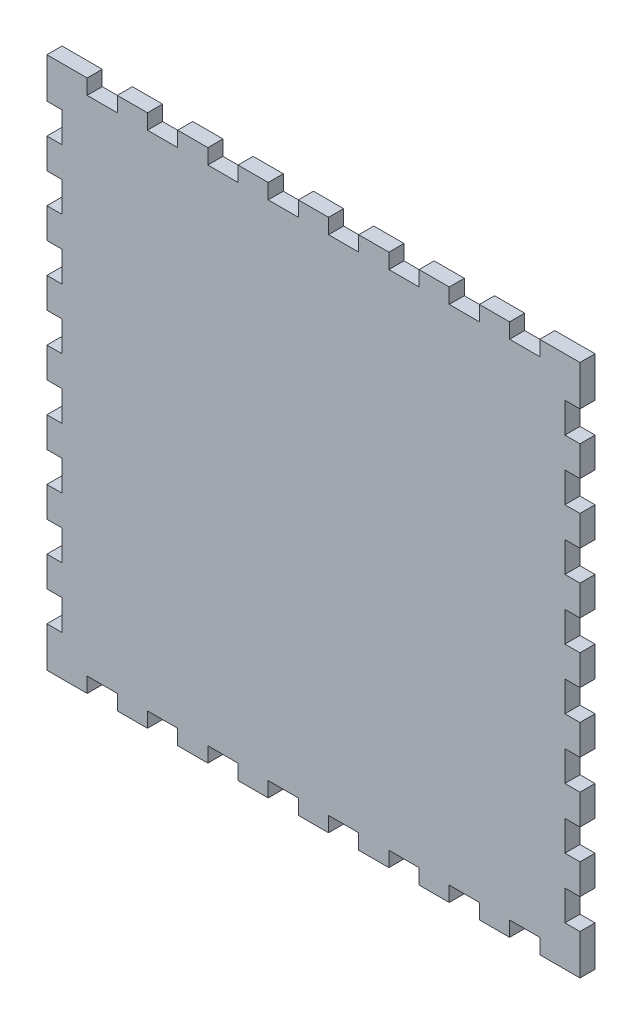
from build123d import *

# Parameters (mm, degrees)
BOSS_EXTRUDE1_DEPTH = 6


with BuildPart() as part:
    # Model → Boss-Extrude1 (new body)
    with BuildSketch(Plane.XY):
        Polygon((0, 215), (0, 199), (6, 199), (6, 187), (0, 187), (0, 175), (6, 175), (6, 163), (0, 163), (0, 151), (6, 151), (6, 139), (0, 139), (0, 127), (6, 127), (6, 115), (0, 115), (0, 103), (6, 103), (6, 91), (0, 91), (0, 79), (6, 79), (6, 67), (0, 67), (0, 55), (6, 55), (6, 43), (0, 43), (0, 31), (6, 31), (6, 19), (0, 19), (0, 3), (16, 3), (16, 9), (28, 9), (28, 3), (40, 3), (40, 9), (52, 9), (52, 3), (64, 3), (64, 9), (76, 9), (76, 3), (88, 3), (88, 9), (100, 9), (100, 3), (112, 3), (112, 9), (124, 9), (124, 3), (136, 3), (136, 9), (148, 9), (148, 3), (160, 3), (160, 9), (172, 9), (172, 3), (184, 3), (184, 9), (196, 9), (196, 3), (212, 3), (212, 19), (206, 19), (206, 31), (212, 31), (212, 43), (206, 43), (206, 55), (212, 55), (212, 67), (206, 67), (206, 79), (212, 79), (212, 91), (206, 91), (206, 103), (212, 103), (212, 115), (206, 115), (206, 127), (212, 127), (212, 139), (206, 139), (206, 151), (212, 151), (212, 163), (206, 163), (206, 175), (212, 175), (212, 187), (206, 187), (206, 199), (212, 199), (212, 215), (196, 215), (196, 209), (184, 209), (184, 215), (172, 215), (172, 209), (160, 209), (160, 215), (148, 215), (148, 209), (136, 209), (136, 215), (124, 215), (124, 209), (112, 209), (112, 215), (100, 215), (100, 209), (88, 209), (88, 215), (76, 215), (76, 209), (64, 209), (64, 215), (52, 215), (52, 209), (40, 209), (40, 215), (28, 215), (28, 209), (16, 209), (16, 215), align=None)
    extrude(amount=BOSS_EXTRUDE1_DEPTH)


solid = part.part
